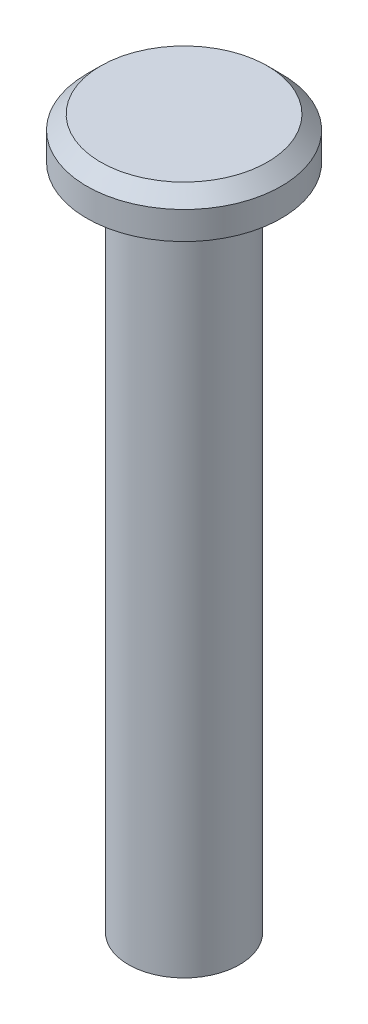
from build123d import *


with BuildPart() as part:
    # Sketch1 → Revolve1 (revolve)
    with BuildSketch(Plane.XY, mode=Mode.PRIVATE) as revolve1_sk:
        Polygon((0, 0), (4, 0), (4, 48), (7, 48), (7, 50), (6, 51), (0, 51), align=None)
    revolve(revolve1_sk.sketch.rotate(Axis((0, 33.604972013, 0), (0, -1, 0)), 180), axis=Axis((0, 33.604972013, 0), (0, -1, 0)))


solid = part.part
